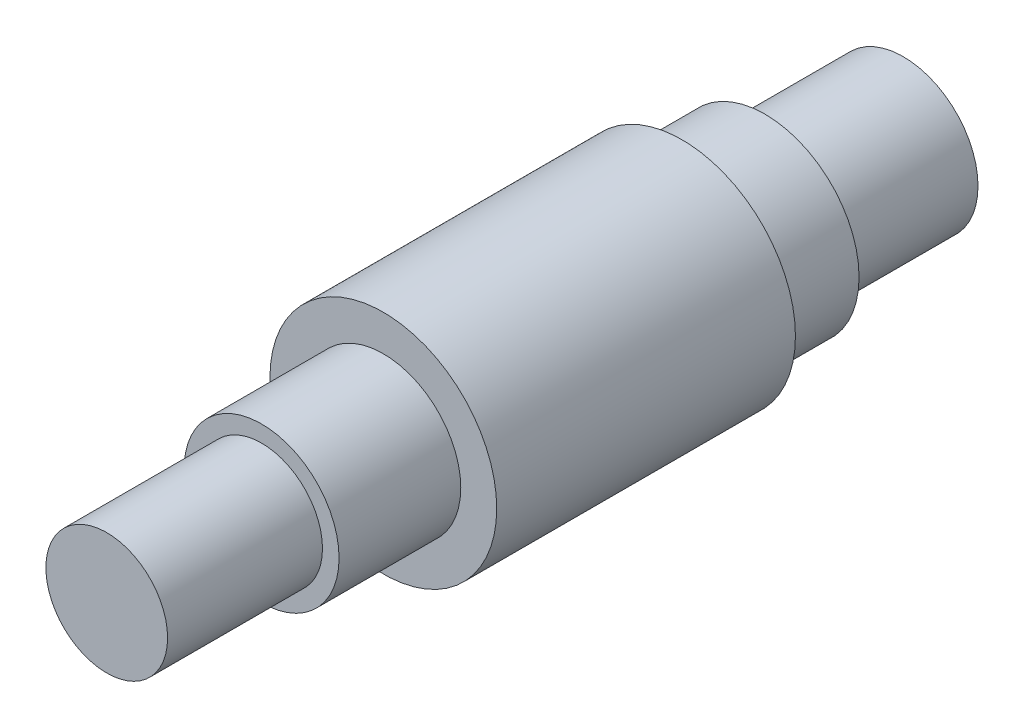
from build123d import *

# Parameters (mm, degrees)
SKETCH1_W   = 14
SKETCH1_H   = 5.5
SKETCH1_W_2 = 12.5
SKETCH1_H_2 = 6.75


with BuildPart() as part:
    # Sketch1 → Revolve2 (revolve)
    with BuildSketch(Plane(origin=(0, 0, 0), x_dir=(0, 0, -1), z_dir=(1, 0, 0)), mode=Mode.PRIVATE) as revolve2_sk:
        with Locations((7, 2.75)):
            Rectangle(SKETCH1_W, SKETCH1_H)
        Polygon((14, 5.5), (14, 0), (25, 0), (25, 7), (14, 7), align=None)
        Polygon((25, 7), (25, 0), (52, 0), (52, 8.5), (52, 10.25), (25, 10.25), align=None)
        Polygon((52, 8.5), (52, 0), (59.5, 0), (59.5, 6.75), (59.5, 8.5), align=None)
        with Locations((65.75, 3.375)):
            Rectangle(SKETCH1_W_2, SKETCH1_H_2)
    revolve(revolve2_sk.sketch.rotate(Axis((0, 0, -25), (0, 0, -1)), 90), axis=Axis((0, 0, -25), (0, 0, -1)))


solid = part.part
